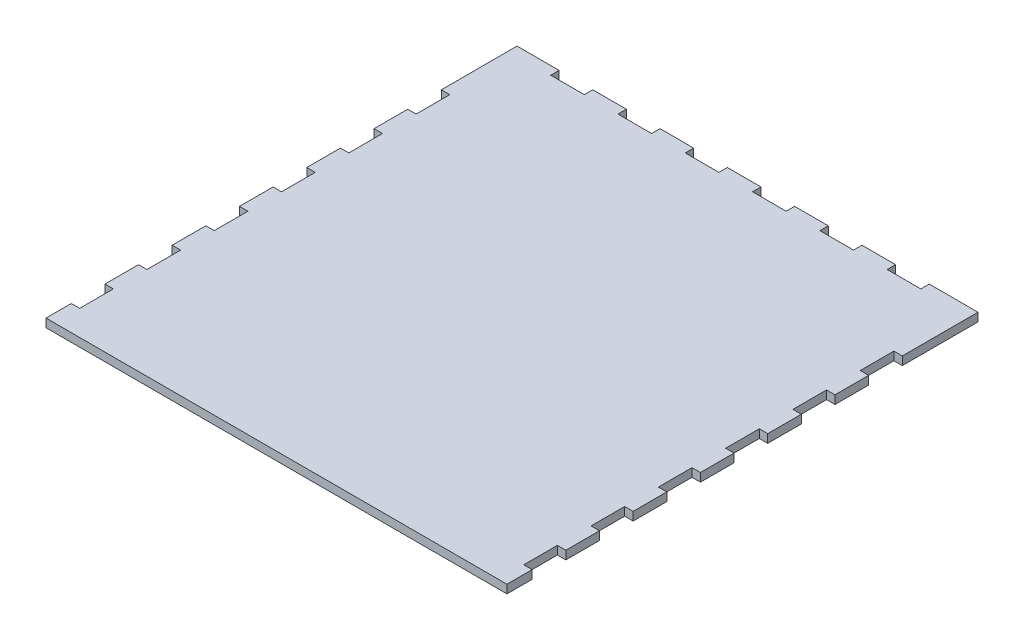
from build123d import *

# Parameters (mm, degrees)
SKETCH1_W           = 173.99
SKETCH1_H           = 177.8
BOSS_EXTRUDE1_DEPTH = 3.175
SKETCH3_W           = 12.7
SKETCH3_H           = 3.175
SKETCH3_W_2         = 3.175
SKETCH3_H_2         = 12.7
CUT_EXTRUDE1_DEPTH  = 3.175


with BuildPart() as part:
    # Sketch1 → Boss-Extrude1 (new body)
    with BuildSketch(Plane(origin=(0, 0, 0), x_dir=(1, 0, 0), z_dir=(0, 1, 0))):
        Rectangle(SKETCH1_W, SKETCH1_H)
    extrude(amount=BOSS_EXTRUDE1_DEPTH)

    # Sketch3 → Cut-Extrude1 (cut)
    with BuildSketch(Plane(origin=(0, 3.175, 0), x_dir=(1, 0, 0), z_dir=(0, 1, 0))):
        with Locations((-64.77, 87.3125)):
            Rectangle(SKETCH3_W, SKETCH3_H)
        with Locations((-39.37, 87.3125)):
            Rectangle(SKETCH3_W, SKETCH3_H)
        with Locations((-13.97, 87.3125)):
            Rectangle(SKETCH3_W, SKETCH3_H)
        with Locations((11.43, 87.3125)):
            Rectangle(SKETCH3_W, SKETCH3_H)
        with Locations((36.83, 87.3125)):
            Rectangle(SKETCH3_W, SKETCH3_H)
        with Locations((62.23, 87.3125)):
            Rectangle(SKETCH3_W, SKETCH3_H)
        with Locations((-85.4075, 28.575)):
            Rectangle(SKETCH3_W_2, SKETCH3_H_2)
        with Locations((-85.4075, 53.975)):
            Rectangle(SKETCH3_W_2, SKETCH3_H_2)
        with Locations((-85.4075, 3.175)):
            Rectangle(SKETCH3_W_2, SKETCH3_H_2)
        with Locations((-85.4075, -22.225)):
            Rectangle(SKETCH3_W_2, SKETCH3_H_2)
        with Locations((-85.4075, -47.625)):
            Rectangle(SKETCH3_W_2, SKETCH3_H_2)
        with Locations((-85.4075, -73.025)):
            Rectangle(SKETCH3_W_2, SKETCH3_H_2)
        with Locations((85.4075, -73.025)):
            Rectangle(SKETCH3_W_2, SKETCH3_H_2)
        with Locations((85.4075, -47.625)):
            Rectangle(SKETCH3_W_2, SKETCH3_H_2)
        with Locations((85.4075, -22.225)):
            Rectangle(SKETCH3_W_2, SKETCH3_H_2)
        with Locations((85.4075, 3.175)):
            Rectangle(SKETCH3_W_2, SKETCH3_H_2)
        with Locations((85.4075, 28.575)):
            Rectangle(SKETCH3_W_2, SKETCH3_H_2)
        with Locations((85.4075, 53.975)):
            Rectangle(SKETCH3_W_2, SKETCH3_H_2)
    extrude(amount=-CUT_EXTRUDE1_DEPTH, mode=Mode.SUBTRACT)


solid = part.part
